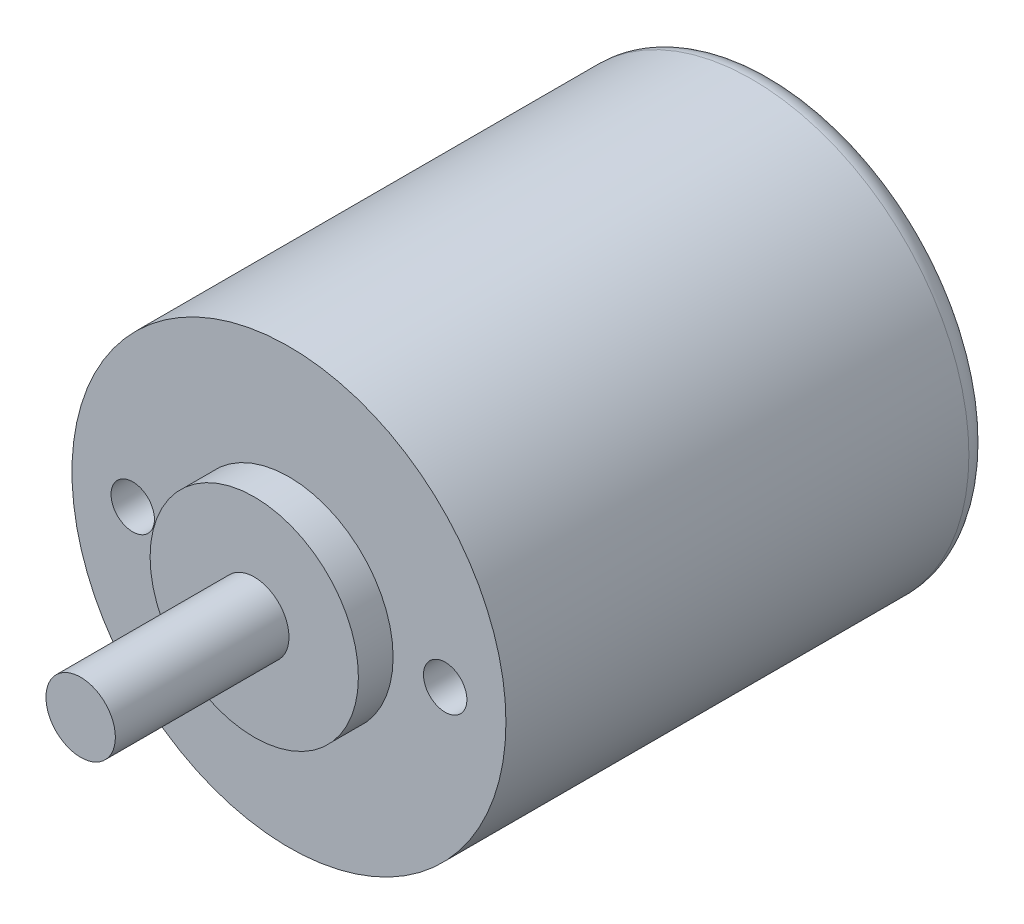
from build123d import *

# Parameters (mm, degrees)
SKETCH1_R                 = 12.5
BOSS_EXTRUDE1_DEPTH       = 27.94
SKETCH2_R                 = 6
BOSS_EXTRUDE2_DEPTH       = 2
SKETCH3_R                 = 2
BOSS_EXTRUDE3_DEPTH       = 10
M3X0_5_TAPPED_HOLE1_D     = 2.5
M3X0_5_TAPPED_HOLE1_DEPTH = 3.999992
M3X0_5_TAPPED_HOLE1_TIP   = 0.751075774
FILLET1_R                 = 1.27


with BuildPart() as part:
    # Sketch1 → Boss-Extrude1 (new body)
    with BuildSketch(Plane.XY):
        Circle(SKETCH1_R)
    extrude(amount=BOSS_EXTRUDE1_DEPTH)

    # Sketch2 → Boss-Extrude2 (add)
    with BuildSketch(Plane.XY.offset(27.94)):
        Circle(SKETCH2_R)
    extrude(amount=BOSS_EXTRUDE2_DEPTH)

    # Sketch3 → Boss-Extrude3 (add)
    with BuildSketch(Plane.XY.offset(29.94)):
        Circle(SKETCH3_R)
    extrude(amount=BOSS_EXTRUDE3_DEPTH)

    # M3x0.5 Tapped Hole1
    with Locations(Plane.XY.offset(27.94)):
        with Locations((-9, 0), (9, 0)):
            Hole(M3X0_5_TAPPED_HOLE1_D / 2, depth=M3X0_5_TAPPED_HOLE1_DEPTH)
            with Locations((0, 0, -(M3X0_5_TAPPED_HOLE1_DEPTH + M3X0_5_TAPPED_HOLE1_TIP / 2))):  # 118° drill point
                Cone(0, M3X0_5_TAPPED_HOLE1_D / 2, M3X0_5_TAPPED_HOLE1_TIP, mode=Mode.SUBTRACT)

    # Fillet1
    fillet1_edges = [part.edges().sort_by_distance(p)[0] for p in [
        (-12.5, 0, 0),
    ]]
    fillet(fillet1_edges, radius=FILLET1_R)


solid = part.part
